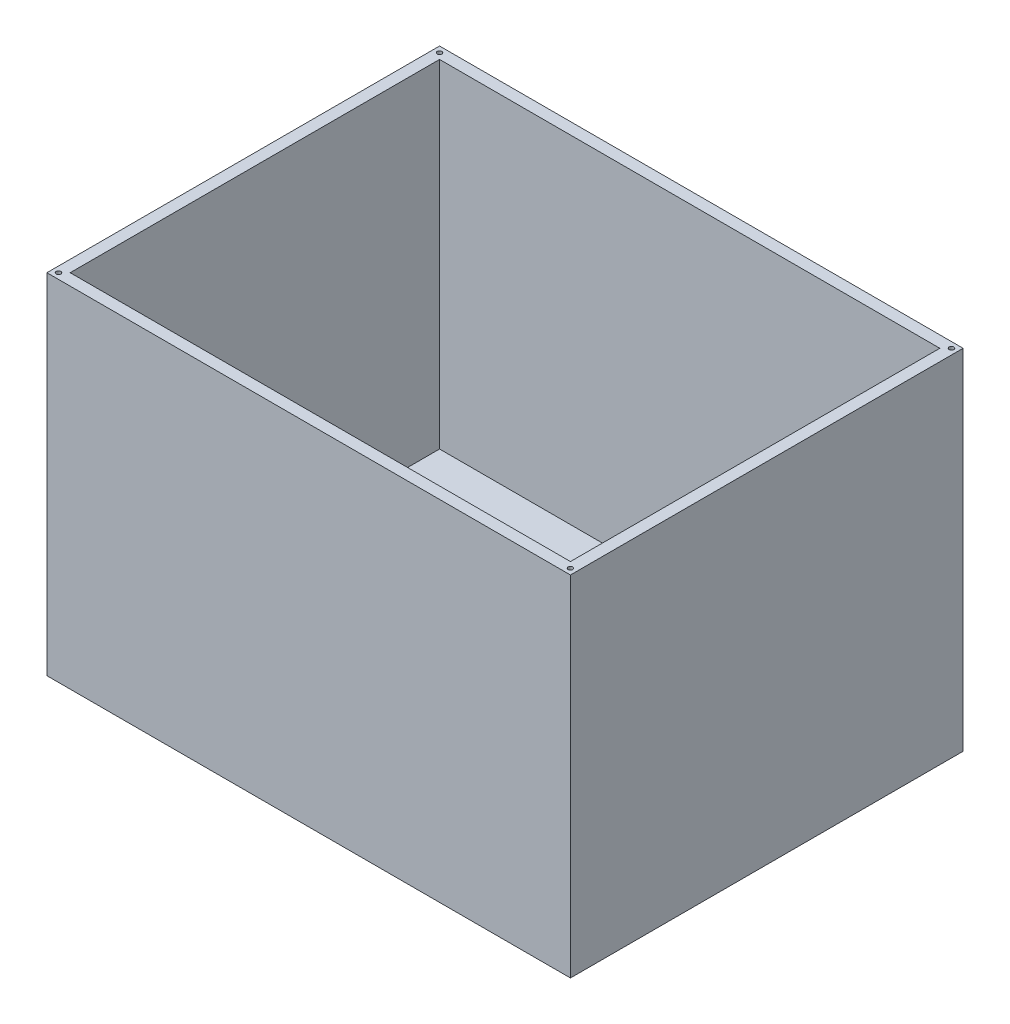
from build123d import *

# Parameters (mm, degrees)
SKETCH1_W           = 900
SKETCH1_H           = 675
BOSS_EXTRUDE1_DEPTH = 600
SHELL1_T            = -20
SKETCH5_R           = 4
CUT_EXTRUDE1_DEPTH  = 20
SKETCH6_R           = 4
CUT_EXTRUDE2_DEPTH  = 20
SKETCH7_R           = 4
CUT_EXTRUDE3_DEPTH  = 20
SKETCH8_R           = 4
CUT_EXTRUDE4_DEPTH  = 20


with BuildPart() as part:
    # Sketch1 → Boss-Extrude1 (new body)
    with BuildSketch(Plane(origin=(0, 0, 0), x_dir=(1, 0, 0), z_dir=(0, 1, 0))):
        Rectangle(SKETCH1_W, SKETCH1_H)
    extrude(amount=BOSS_EXTRUDE1_DEPTH)

    # Shell1
    shell1_openings = [part.faces().sort_by_distance(p)[0] for p in [
        (0, 600, 0),
    ]]
    offset(amount=SHELL1_T, openings=shell1_openings, kind=Kind.INTERSECTION)

    # Sketch5 → Cut-Extrude1 (cut)
    with BuildSketch(Plane(origin=(0, 600, 0), x_dir=(1, 0, 0), z_dir=(0, 1, 0))):
        with Locations(Location((-440, -327.5, 0), (0, 0, 270))):
            Circle(SKETCH5_R)
    extrude(amount=-CUT_EXTRUDE1_DEPTH, mode=Mode.SUBTRACT)

    # Sketch6 → Cut-Extrude2 (cut)
    with BuildSketch(Plane(origin=(0, 600, 0), x_dir=(1, 0, 0), z_dir=(0, 1, 0))):
        with Locations(Location((440, -327.5, 0), (0, 0, 270))):
            Circle(SKETCH6_R)
    extrude(amount=-CUT_EXTRUDE2_DEPTH, mode=Mode.SUBTRACT)

    # Sketch7 → Cut-Extrude3 (cut)
    with BuildSketch(Plane(origin=(0, 600, 0), x_dir=(1, 0, 0), z_dir=(0, 1, 0))):
        with Locations(Location((440, 327.5, 0), (0, 0, 270))):
            Circle(SKETCH7_R)
    extrude(amount=-CUT_EXTRUDE3_DEPTH, mode=Mode.SUBTRACT)

    # Sketch8 → Cut-Extrude4 (cut)
    with BuildSketch(Plane(origin=(0, 600, 0), x_dir=(1, 0, 0), z_dir=(0, 1, 0))):
        with Locations(Location((-440, 327.5, 0), (0, 0, 270))):
            Circle(SKETCH8_R)
    extrude(amount=-CUT_EXTRUDE4_DEPTH, mode=Mode.SUBTRACT)


solid = part.part
